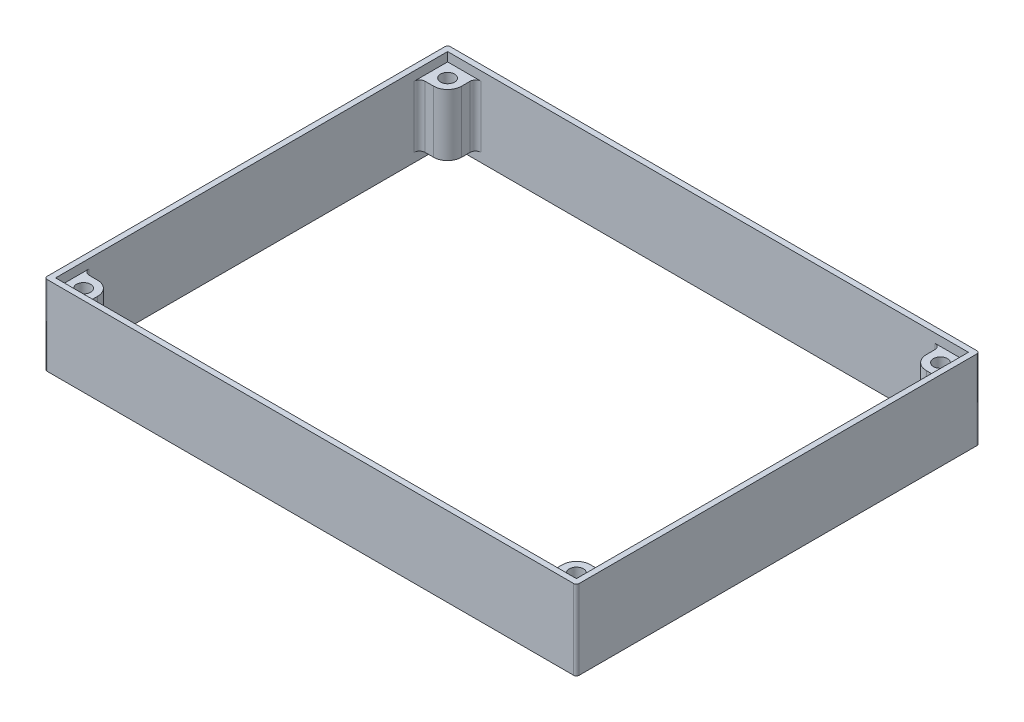
from build123d import *

# Parameters (mm, degrees)
SKETCH1_W           = 95
SKETCH1_H           = 72
SKETCH1_R           = 1.25
BOSS_EXTRUDE1_DEPTH = 14.2
FILLET1_R           = 0.5
FILLET2_R           = 1
SKETCH2_W           = 93
SKETCH2_H           = 70
CUT_EXTRUDE1_DEPTH  = 1.6
SKETCH3_W           = 93
SKETCH3_H           = 70
CUT_EXTRUDE2_DEPTH  = 1.6


with BuildPart() as part:
    # Sketch1 → Boss-Extrude1 (new body)
    with BuildSketch(Plane(origin=(0, 0, 0), x_dir=(1, 0, 0), z_dir=(0, 1, 0))):
        Rectangle(SKETCH1_W, SKETCH1_H)
        with Locations(Location((-44, 32.5, 0), (0, 0, 270))):
            Circle(SKETCH1_R, mode=Mode.SUBTRACT)
        with Locations(Location((44, 32.5, 0), (0, 0, 90))):
            Circle(SKETCH1_R, mode=Mode.SUBTRACT)
        with Locations(Location((44, -32.5, 0), (0, 0, 270))):
            Circle(SKETCH1_R, mode=Mode.SUBTRACT)
        with Locations(Location((-44, -32.5, 0), (0, 0, 90))):
            Circle(SKETCH1_R, mode=Mode.SUBTRACT)
        with BuildLine():
            Line((-44, 30), (-46.5, 30))
            Line((-46.5, 30), (-46.5, -30))
            Line((-46.5, -30), (-44, -30))
            ThreePointArc((-44, -30), (-42.232233047, -30.732233047), (-41.5, -32.5))
            Line((-41.5, -32.5), (-41.5, -35))
            Line((-41.5, -35), (41.5, -35))
            Line((41.5, -35), (41.5, -32.5))
            ThreePointArc((41.5, -32.5), (42.232233047, -30.732233047), (44, -30))
            Line((44, -30), (46.5, -30))
            Line((46.5, -30), (46.5, 30))
            Line((46.5, 30), (44, 30))
            ThreePointArc((44, 30), (42.232233047, 30.732233047), (41.5, 32.5))
            Line((41.5, 32.5), (41.5, 35))
            Line((41.5, 35), (-41.5, 35))
            Line((-41.5, 35), (-41.5, 32.5))
            ThreePointArc((-41.5, 32.5), (-42.232233047, 30.732233047), (-44, 30))
        make_face(mode=Mode.SUBTRACT)
    extrude(amount=BOSS_EXTRUDE1_DEPTH)

    # Fillet1
    fillet1_edges = [part.edges().sort_by_distance(p)[0] for p in [
        (47.5, 7.1, -36),
        (47.5, 7.1, 36),
        (-47.5, 7.1, 36),
        (-47.5, 7.1, -36),
    ]]
    fillet(fillet1_edges, radius=FILLET1_R)

    # Fillet2
    fillet2_edges = [part.edges().sort_by_distance(p)[0] for p in [
        (-46.5, 7.1, -30),
        (-46.5, 7.1, 30),
        (-41.5, 7.1, 35),
        (41.5, 7.1, 35),
        (46.5, 7.1, 30),
        (46.5, 7.1, -30),
        (41.5, 7.1, -35),
        (-41.5, 7.1, -35),
    ]]
    fillet(fillet2_edges, radius=FILLET2_R)

    # Sketch2 → Cut-Extrude1 (cut)
    with BuildSketch(Plane(origin=(0, 14.2, 0), x_dir=(1, 0, 0), z_dir=(0, 1, 0))):
        Rectangle(SKETCH2_W, SKETCH2_H)
    extrude(amount=-CUT_EXTRUDE1_DEPTH, mode=Mode.SUBTRACT)

    # Sketch3 → Cut-Extrude2 (cut)
    with BuildSketch(Plane.XZ):
        Rectangle(SKETCH3_W, SKETCH3_H)
    extrude(amount=-CUT_EXTRUDE2_DEPTH, mode=Mode.SUBTRACT)


solid = part.part
